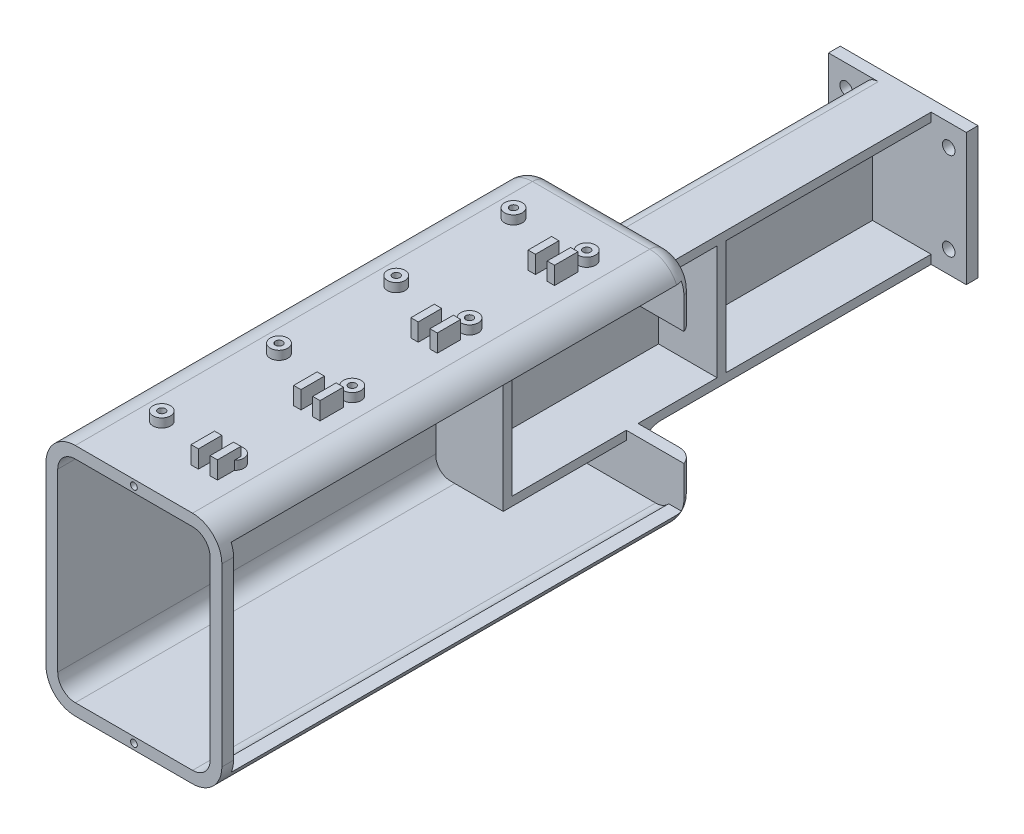
from build123d import *

# Parameters (mm, degrees)
EXTRUDE_1_DEPTH     = 150
FILLET_1_R          = 5
SKETCH_2_W          = 47
SKETCH_2_H          = 45
SKETCH_2_R          = 2.15
EXTRUDE_2_DEPTH     = 4
EXTRUDE_START       = 74
SKETCH_3_W          = 20.5
SKETCH_3_H          = 40
EXTRUDE_3_DEPTH     = 3
EXTRUDE_START_2     = 147
SKETCH_4_W          = 20.5
SKETCH_4_H          = 40
EXTRUDE_4_DEPTH     = 3
EXTRUDE_START_3     = 104
EXTRUDE_5_DEPTH     = 4
EXTRUDE_START_4     = 108
EXTRUDE_6_DEPTH     = 158
FILLET_2_R          = 8
FILLET_3_R          = 6
CUT_EXTRUDE_START   = 77
SKETCH_7_W          = 45
SKETCH_7_H          = 39
CUT_EXTRUDE_1_DEPTH = 70
CUT_EXTRUDE_START_2 = 108
SKETCH_8_W          = 11
SKETCH_8_H          = 68
CUT_EXTRUDE_2_DEPTH = 154
CUT_EXTRUDE_START_3 = 258
SKETCH_9_R          = 1.15
CUT_EXTRUDE_3_DEPTH = 8
EXTRUDE_START_5     = 40
SKETCH_10_R         = 3
SKETCH_10_R_2       = 1.25
EXTRUDE_7_DEPTH     = 3
EXTRUDE_START_6     = -43
SKETCH_11_R         = 3
SKETCH_11_R_2       = 1.25
EXTRUDE_8_DEPTH     = 3
EXTRUDE_START_7     = -30
SKETCH_12_R         = 3
SKETCH_12_R_2       = 1.25
EXTRUDE_9_DEPTH     = 3
SKETCH_13_W         = 2.5
SKETCH_13_H         = 8
EXTRUDE_10_DEPTH    = 6
EXTRUDE_START_8     = -40
SKETCH_14_W         = 2.5
SKETCH_14_H         = 8
EXTRUDE_11_DEPTH    = 6


with BuildPart() as part:
    # 草圖1 → 填料-伸長1 (new body)
    with BuildSketch(Plane.XY):
        Polygon((-13, -22.5), (10, -22.5), (10, -19.5), (-10, -19.5), (-10, 19.5), (10, 19.5), (10, 22.5), (-13, 22.5), align=None)
    extrude(amount=EXTRUDE_1_DEPTH)

    # 圓角1
    fillet_1_edges = [part.edges().sort_by_distance(p)[0] for p in [
        (-13, 22.5, 75),
        (-13, -22.5, 75),
    ]]
    fillet(fillet_1_edges, radius=FILLET_1_R)

    # 草圖2 → 填料-伸長2 (add)
    with BuildSketch(Plane.XY):
        with Locations((-1.5, 0)):
            Rectangle(SKETCH_2_W, SKETCH_2_H)
        with Locations((-19, 15)):
            Circle(SKETCH_2_R, mode=Mode.SUBTRACT)
        with Locations((-19, -15)):
            Circle(SKETCH_2_R, mode=Mode.SUBTRACT)
        with Locations((16, 15)):
            Circle(SKETCH_2_R, mode=Mode.SUBTRACT)
        with Locations((16, -15)):
            Circle(SKETCH_2_R, mode=Mode.SUBTRACT)
    extrude(amount=EXTRUDE_2_DEPTH)

    # 草圖3 → 填料-伸長3 (add)
    with BuildSketch(Plane.XY.offset(EXTRUDE_START)):
        with Locations((-0.25, 0)):
            Rectangle(SKETCH_3_W, SKETCH_3_H)
    extrude(amount=EXTRUDE_3_DEPTH)

    # 草圖4 → 填料-伸長4 (add)
    with BuildSketch(Plane.XY.offset(EXTRUDE_START_2)):
        with Locations((-0.25, 0)):
            Rectangle(SKETCH_4_W, SKETCH_4_H)
    extrude(amount=EXTRUDE_4_DEPTH)

    # 草圖5 → 填料-伸長5 (add)
    with BuildSketch(Plane.XY.offset(EXTRUDE_START_3)):
        with BuildLine():
            Line((30, -30), (30, 30))
            ThreePointArc((30, 30), (27.071067812, 37.071067812), (20, 40))
            Line((20, 40), (-20, 40))
            ThreePointArc((-20, 40), (-27.071067812, 37.071067812), (-30, 30))
            Line((-30, 30), (-30, -30))
            ThreePointArc((-30, -30), (-27.071067812, -37.071067812), (-20, -40))
            Line((-20, -40), (20, -40))
            ThreePointArc((20, -40), (27.071067812, -37.071067812), (30, -30))
        make_face()
    extrude(amount=EXTRUDE_5_DEPTH)

    # 草圖6 → 填料-伸長6 (add)
    with BuildSketch(Plane.XY.offset(EXTRUDE_START_4)):
        with BuildLine():
            Line((30, -30), (30, 30))
            ThreePointArc((30, 30), (27.071067812, 37.071067812), (20, 40))
            Line((20, 40), (-20, 40))
            ThreePointArc((-20, 40), (-27.071067812, 37.071067812), (-30, 30))
            Line((-30, 30), (-30, -30))
            ThreePointArc((-30, -30), (-27.071067812, -37.071067812), (-20, -40))
            Line((-20, -40), (20, -40))
            ThreePointArc((20, -40), (27.071067812, -37.071067812), (30, -30))
        make_face()
        with BuildLine():
            Line((26, -30), (26, 30))
            ThreePointArc((26, 30), (24.242640687, 34.242640687), (20, 36))
            Line((20, 36), (-20, 36))
            ThreePointArc((-20, 36), (-24.242640687, 34.242640687), (-26, 30))
            Line((-26, 30), (-26, -30))
            ThreePointArc((-26, -30), (-24.242640687, -34.242640687), (-20, -36))
            Line((-20, -36), (20, -36))
            ThreePointArc((20, -36), (24.242640687, -34.242640687), (26, -30))
        make_face(mode=Mode.SUBTRACT)
    extrude(amount=EXTRUDE_6_DEPTH)

    # 圓角2
    fillet_2_edges = [part.edges().sort_by_distance(p)[0] for p in [
        (-11.535533906, -21.035533906, 104),
        (1, 22.5, 104),
        (-13, 0, 104),
        (1, -22.5, 104),
        (-11.535533906, 21.035533906, 104),
    ]]
    fillet(fillet_2_edges, radius=FILLET_2_R)

    # 圓角3
    fillet_3_edges = [part.edges().sort_by_distance(p)[0] for p in [
        (27.071067812, -37.071067812, 104),
        (30, 0, 104),
        (27.071067812, 37.071067812, 104),
        (0, 40, 104),
        (-27.071067812, 37.071067812, 104),
        (-30, 0, 104),
        (-27.071067812, -37.071067812, 104),
        (0, -40, 104),
    ]]
    fillet(fillet_3_edges, radius=FILLET_3_R)

    # 草圖7 → 除料-伸長1 (cut)
    with BuildSketch(Plane.XY.offset(CUT_EXTRUDE_START)):
        with Locations((12.5, 0)):
            Rectangle(SKETCH_7_W, SKETCH_7_H)
    extrude(amount=CUT_EXTRUDE_1_DEPTH, mode=Mode.SUBTRACT)

    # 草圖8 → 除料-伸長2 (cut)
    with BuildSketch(Plane.XY.offset(CUT_EXTRUDE_START_2)):
        with Locations((29.5, 0)):
            Rectangle(SKETCH_8_W, SKETCH_8_H)
    extrude(amount=CUT_EXTRUDE_2_DEPTH, mode=Mode.SUBTRACT)

    # 草圖9 → 除料-伸長3 (cut)
    with BuildSketch(Plane.XY.offset(CUT_EXTRUDE_START_3)):
        with Locations((0, 38)):
            Circle(SKETCH_9_R)
        with Locations((0, -38)):
            Circle(SKETCH_9_R)
    extrude(amount=CUT_EXTRUDE_3_DEPTH, mode=Mode.SUBTRACT)

    # 草圖10 → 填料-伸長7 (add)
    # profile 1 of 8: a face of its own
    with BuildSketch(Plane(origin=(0, 0, 0), x_dir=(1, 0, 0), z_dir=(0, 1, 0)).offset(EXTRUDE_START_5)):
        with Locations(Location((-12.5, -124, 0), (0, 0, 90))):
            Circle(SKETCH_10_R)
        with Locations(Location((-12.5, -124, 0), (0, 0, 270))):
            Circle(SKETCH_10_R_2, mode=Mode.SUBTRACT)
    # profile 2 of 8: a face of its own
    with BuildSketch(Plane(origin=(0, 0, 0), x_dir=(1, 0, 0), z_dir=(0, 1, 0)).offset(EXTRUDE_START_5)):
        with Locations(Location((-12.5, -164, 0), (0, 0, 90))):
            Circle(SKETCH_10_R)
        with Locations(Location((-12.5, -164, 0), (0, 0, 270))):
            Circle(SKETCH_10_R_2, mode=Mode.SUBTRACT)
    # profile 3 of 8: a face of its own
    with BuildSketch(Plane(origin=(0, 0, 0), x_dir=(1, 0, 0), z_dir=(0, 1, 0)).offset(EXTRUDE_START_5)):
        with Locations(Location((-12.5, -204, 0), (0, 0, 90))):
            Circle(SKETCH_10_R)
        with Locations(Location((-12.5, -204, 0), (0, 0, 270))):
            Circle(SKETCH_10_R_2, mode=Mode.SUBTRACT)
    # profile 4 of 8: a face of its own
    with BuildSketch(Plane(origin=(0, 0, 0), x_dir=(1, 0, 0), z_dir=(0, 1, 0)).offset(EXTRUDE_START_5)):
        with Locations(Location((-12.5, -244, 0), (0, 0, 90))):
            Circle(SKETCH_10_R)
        with Locations(Location((-12.5, -244, 0), (0, 0, 270))):
            Circle(SKETCH_10_R_2, mode=Mode.SUBTRACT)
    # profile 5 of 8: a face of its own
    with BuildSketch(Plane(origin=(0, 0, 0), x_dir=(1, 0, 0), z_dir=(0, 1, 0)).offset(EXTRUDE_START_5)):
        with Locations(Location((12.5, -124, 0), (0, 0, 90))):
            Circle(SKETCH_10_R)
        with Locations(Location((12.5, -124, 0), (0, 0, 270))):
            Circle(SKETCH_10_R_2, mode=Mode.SUBTRACT)
    # profile 6 of 8: a face of its own
    with BuildSketch(Plane(origin=(0, 0, 0), x_dir=(1, 0, 0), z_dir=(0, 1, 0)).offset(EXTRUDE_START_5)):
        with Locations(Location((12.5, -164, 0), (0, 0, 90))):
            Circle(SKETCH_10_R)
        with Locations(Location((12.5, -164, 0), (0, 0, 270))):
            Circle(SKETCH_10_R_2, mode=Mode.SUBTRACT)
    # profile 7 of 8: a face of its own
    with BuildSketch(Plane(origin=(0, 0, 0), x_dir=(1, 0, 0), z_dir=(0, 1, 0)).offset(EXTRUDE_START_5)):
        with Locations(Location((12.5, -204, 0), (0, 0, 90))):
            Circle(SKETCH_10_R)
        with Locations(Location((12.5, -204, 0), (0, 0, 270))):
            Circle(SKETCH_10_R_2, mode=Mode.SUBTRACT)
    # profile 8 of 8: a face of its own
    with BuildSketch(Plane(origin=(0, 0, 0), x_dir=(1, 0, 0), z_dir=(0, 1, 0)).offset(EXTRUDE_START_5)):
        with Locations(Location((12.5, -244, 0), (0, 0, 90))):
            Circle(SKETCH_10_R)
        with Locations(Location((12.5, -244, 0), (0, 0, 270))):
            Circle(SKETCH_10_R_2, mode=Mode.SUBTRACT)
    extrude(amount=EXTRUDE_7_DEPTH)

    # 草圖11 → 填料-伸長8 (add)
    # profile 1 of 8: a face of its own
    with BuildSketch(Plane(origin=(0, 0, 0), x_dir=(1, 0, 0), z_dir=(0, 1, 0)).offset(EXTRUDE_START_6)):
        with Locations(Location((-12.5, -124, 0), (0, 0, 90))):
            Circle(SKETCH_11_R)
        with Locations(Location((-12.5, -124, 0), (0, 0, 270))):
            Circle(SKETCH_11_R_2, mode=Mode.SUBTRACT)
    # profile 2 of 8: a face of its own
    with BuildSketch(Plane(origin=(0, 0, 0), x_dir=(1, 0, 0), z_dir=(0, 1, 0)).offset(EXTRUDE_START_6)):
        with Locations(Location((-12.5, -164, 0), (0, 0, 90))):
            Circle(SKETCH_11_R)
        with Locations(Location((-12.5, -164, 0), (0, 0, 270))):
            Circle(SKETCH_11_R_2, mode=Mode.SUBTRACT)
    # profile 3 of 8: a face of its own
    with BuildSketch(Plane(origin=(0, 0, 0), x_dir=(1, 0, 0), z_dir=(0, 1, 0)).offset(EXTRUDE_START_6)):
        with Locations(Location((-12.5, -204, 0), (0, 0, 90))):
            Circle(SKETCH_11_R)
        with Locations(Location((-12.5, -204, 0), (0, 0, 270))):
            Circle(SKETCH_11_R_2, mode=Mode.SUBTRACT)
    # profile 4 of 8: a face of its own
    with BuildSketch(Plane(origin=(0, 0, 0), x_dir=(1, 0, 0), z_dir=(0, 1, 0)).offset(EXTRUDE_START_6)):
        with Locations(Location((-12.5, -244, 0), (0, 0, 90))):
            Circle(SKETCH_11_R)
        with Locations(Location((-12.5, -244, 0), (0, 0, 270))):
            Circle(SKETCH_11_R_2, mode=Mode.SUBTRACT)
    # profile 5 of 8: a face of its own
    with BuildSketch(Plane(origin=(0, 0, 0), x_dir=(1, 0, 0), z_dir=(0, 1, 0)).offset(EXTRUDE_START_6)):
        with Locations(Location((12.5, -124, 0), (0, 0, 90))):
            Circle(SKETCH_11_R)
        with Locations(Location((12.5, -124, 0), (0, 0, 270))):
            Circle(SKETCH_11_R_2, mode=Mode.SUBTRACT)
    # profile 6 of 8: a face of its own
    with BuildSketch(Plane(origin=(0, 0, 0), x_dir=(1, 0, 0), z_dir=(0, 1, 0)).offset(EXTRUDE_START_6)):
        with Locations(Location((12.5, -164, 0), (0, 0, 90))):
            Circle(SKETCH_11_R)
        with Locations(Location((12.5, -164, 0), (0, 0, 270))):
            Circle(SKETCH_11_R_2, mode=Mode.SUBTRACT)
    # profile 7 of 8: a face of its own
    with BuildSketch(Plane(origin=(0, 0, 0), x_dir=(1, 0, 0), z_dir=(0, 1, 0)).offset(EXTRUDE_START_6)):
        with Locations(Location((12.5, -204, 0), (0, 0, 90))):
            Circle(SKETCH_11_R)
        with Locations(Location((12.5, -204, 0), (0, 0, 270))):
            Circle(SKETCH_11_R_2, mode=Mode.SUBTRACT)
    # profile 8 of 8: a face of its own
    with BuildSketch(Plane(origin=(0, 0, 0), x_dir=(1, 0, 0), z_dir=(0, 1, 0)).offset(EXTRUDE_START_6)):
        with Locations(Location((12.5, -244, 0), (0, 0, 90))):
            Circle(SKETCH_11_R)
        with Locations(Location((12.5, -244, 0), (0, 0, 270))):
            Circle(SKETCH_11_R_2, mode=Mode.SUBTRACT)
    extrude(amount=EXTRUDE_8_DEPTH)

    # 草圖12 → 填料-伸長9 (add)
    # profile 1 of 8: a face of its own
    with BuildSketch(Plane(origin=(0, 0, 0), x_dir=(0, 0, -1), z_dir=(1, 0, 0)).offset(EXTRUDE_START_7)):
        with Locations((-124, -15)):
            Circle(SKETCH_12_R)
        with Locations((-124, -15)):
            Circle(SKETCH_12_R_2, mode=Mode.SUBTRACT)
    # profile 2 of 8: a face of its own
    with BuildSketch(Plane(origin=(0, 0, 0), x_dir=(0, 0, -1), z_dir=(1, 0, 0)).offset(EXTRUDE_START_7)):
        with Locations((-164, -15)):
            Circle(SKETCH_12_R)
        with Locations((-164, -15)):
            Circle(SKETCH_12_R_2, mode=Mode.SUBTRACT)
    # profile 3 of 8: a face of its own
    with BuildSketch(Plane(origin=(0, 0, 0), x_dir=(0, 0, -1), z_dir=(1, 0, 0)).offset(EXTRUDE_START_7)):
        with Locations((-204, -15)):
            Circle(SKETCH_12_R)
        with Locations((-204, -15)):
            Circle(SKETCH_12_R_2, mode=Mode.SUBTRACT)
    # profile 4 of 8: a face of its own
    with BuildSketch(Plane(origin=(0, 0, 0), x_dir=(0, 0, -1), z_dir=(1, 0, 0)).offset(EXTRUDE_START_7)):
        with Locations((-244, -15)):
            Circle(SKETCH_12_R)
        with Locations((-244, -15)):
            Circle(SKETCH_12_R_2, mode=Mode.SUBTRACT)
    # profile 5 of 8: a face of its own
    with BuildSketch(Plane(origin=(0, 0, 0), x_dir=(0, 0, -1), z_dir=(1, 0, 0)).offset(EXTRUDE_START_7)):
        with Locations((-124, 15)):
            Circle(SKETCH_12_R)
        with Locations((-124, 15)):
            Circle(SKETCH_12_R_2, mode=Mode.SUBTRACT)
    # profile 6 of 8: a face of its own
    with BuildSketch(Plane(origin=(0, 0, 0), x_dir=(0, 0, -1), z_dir=(1, 0, 0)).offset(EXTRUDE_START_7)):
        with Locations((-164, 15)):
            Circle(SKETCH_12_R)
        with Locations((-164, 15)):
            Circle(SKETCH_12_R_2, mode=Mode.SUBTRACT)
    # profile 7 of 8: a face of its own
    with BuildSketch(Plane(origin=(0, 0, 0), x_dir=(0, 0, -1), z_dir=(1, 0, 0)).offset(EXTRUDE_START_7)):
        with Locations((-204, 15)):
            Circle(SKETCH_12_R)
        with Locations((-204, 15)):
            Circle(SKETCH_12_R_2, mode=Mode.SUBTRACT)
    # profile 8 of 8: a face of its own
    with BuildSketch(Plane(origin=(0, 0, 0), x_dir=(0, 0, -1), z_dir=(1, 0, 0)).offset(EXTRUDE_START_7)):
        with Locations((-244, 15)):
            Circle(SKETCH_12_R)
        with Locations((-244, 15)):
            Circle(SKETCH_12_R_2, mode=Mode.SUBTRACT)
    extrude(amount=-EXTRUDE_9_DEPTH)

    # 草圖13 → 填料-伸長10 (add)
    with BuildSketch(Plane(origin=(0, 0, 0), x_dir=(1, 0, 0), z_dir=(0, 1, 0)).offset(EXTRUDE_START_5)):
        with Locations((6.75, -133)):
            Rectangle(SKETCH_13_W, SKETCH_13_H)
        with Locations((13.25, -133)):
            Rectangle(SKETCH_13_W, SKETCH_13_H)
        with Locations((6.75, -173)):
            Rectangle(SKETCH_13_W, SKETCH_13_H)
        with Locations((13.25, -173)):
            Rectangle(SKETCH_13_W, SKETCH_13_H)
        with Locations((6.75, -213)):
            Rectangle(SKETCH_13_W, SKETCH_13_H)
        with Locations((13.25, -213)):
            Rectangle(SKETCH_13_W, SKETCH_13_H)
        with Locations((6.75, -248)):
            Rectangle(SKETCH_13_W, SKETCH_13_H)
        with Locations((13.25, -248)):
            Rectangle(SKETCH_13_W, SKETCH_13_H)
    extrude(amount=EXTRUDE_10_DEPTH)

    # 草圖14 → 填料-伸長11 (add)
    with BuildSketch(Plane(origin=(0, 0, 0), x_dir=(1, 0, 0), z_dir=(0, 1, 0)).offset(EXTRUDE_START_8)):
        with Locations((6.75, -133)):
            Rectangle(SKETCH_14_W, SKETCH_14_H)
        with Locations((13.25, -133)):
            Rectangle(SKETCH_14_W, SKETCH_14_H)
        with Locations((6.75, -173)):
            Rectangle(SKETCH_14_W, SKETCH_14_H)
        with Locations((13.25, -173)):
            Rectangle(SKETCH_14_W, SKETCH_14_H)
        with Locations((6.75, -213)):
            Rectangle(SKETCH_14_W, SKETCH_14_H)
        with Locations((13.25, -213)):
            Rectangle(SKETCH_14_W, SKETCH_14_H)
        with Locations((6.75, -248)):
            Rectangle(SKETCH_14_W, SKETCH_14_H)
        with Locations((13.25, -248)):
            Rectangle(SKETCH_14_W, SKETCH_14_H)
    extrude(amount=-EXTRUDE_11_DEPTH)


solid = part.part
